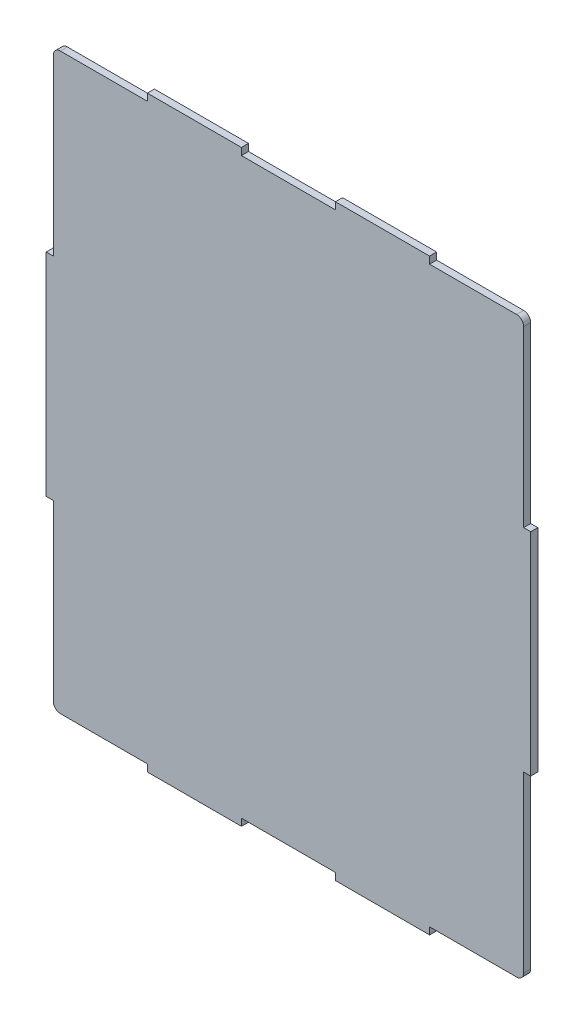
from build123d import *

# Parameters (mm, degrees)
SKETCH1_W           = 40
SKETCH1_H           = 3
SKETCH1_W_2         = 3
SKETCH1_H_2         = 90
BOSS_EXTRUDE1_DEPTH = 3


with BuildPart() as part:
    # Sketch1 → Boss-Extrude1 (new body)
    with BuildSketch(Plane.XY):
        with BuildLine():
            Line((97, 122), (-97, 122))
            ThreePointArc((-97, 122), (-99.121320344, 121.121320344), (-100, 119))
            Line((-100, 119), (-100, -119))
            ThreePointArc((-100, -119), (-99.121320344, -121.121320344), (-97, -122))
            Line((-97, -122), (97, -122))
            ThreePointArc((97, -122), (99.121320344, -121.121320344), (100, -119))
            Line((100, -119), (100, 119))
            ThreePointArc((100, 119), (99.121320344, 121.121320344), (97, 122))
        make_face()
        with Locations((-40, 123.5)):
            Rectangle(SKETCH1_W, SKETCH1_H)
        with Locations((40, 123.5)):
            Rectangle(SKETCH1_W, SKETCH1_H)
        with Locations((-101.5, 0)):
            Rectangle(SKETCH1_W_2, SKETCH1_H_2)
        with Locations((101.5, 0)):
            Rectangle(SKETCH1_W_2, SKETCH1_H_2)
        with Locations((40, -123.5)):
            Rectangle(SKETCH1_W, SKETCH1_H)
        with Locations((-40, -123.5)):
            Rectangle(SKETCH1_W, SKETCH1_H)
    extrude(amount=BOSS_EXTRUDE1_DEPTH)


solid = part.part
